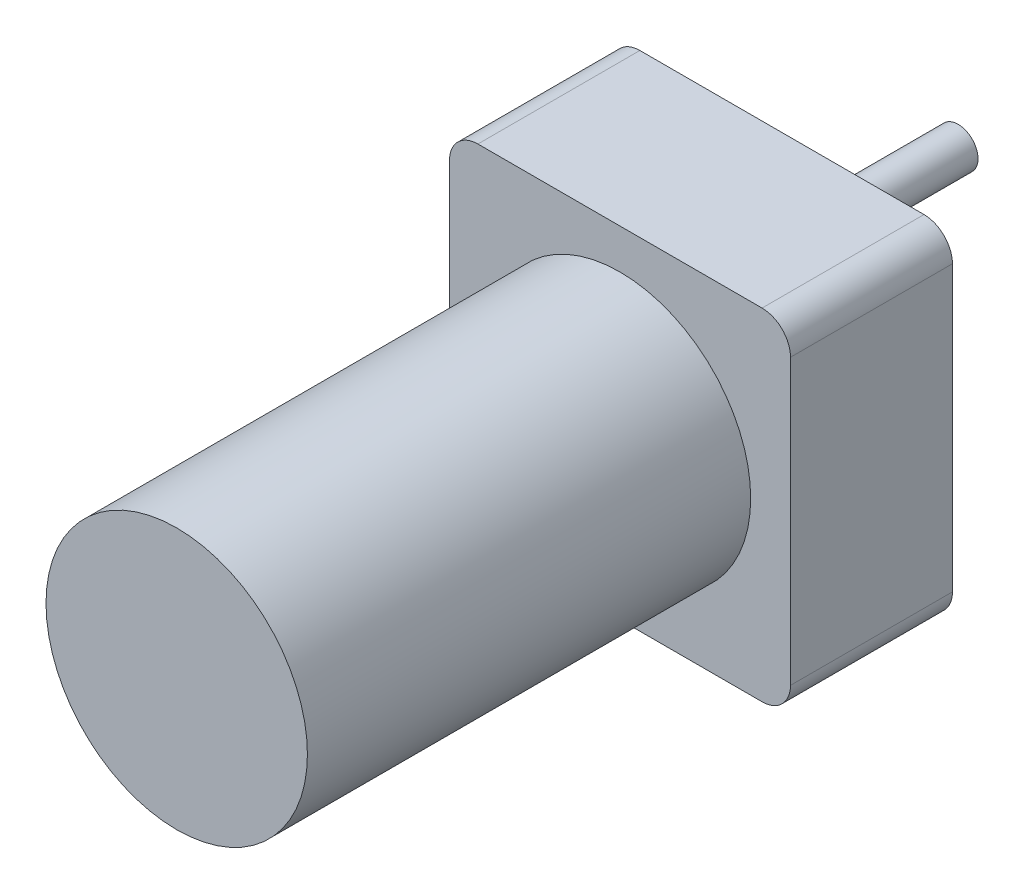
from build123d import *

# Parameters (mm, degrees)
BOSS_EXTRUDE1_DEPTH = 28.5
SKETCH2_R           = 23
BOSS_EXTRUDE2_DEPTH = 78
SKETCH3_R           = 9.125
BOSS_EXTRUDE3_DEPTH = 6
SKETCH4_R           = 3.5
BOSS_EXTRUDE4_DEPTH = 25
CUT_EXTRUDE1_START  = -18
CUT_EXTRUDE1_DEPTH  = 18
SKETCH6_R           = 2.4
CUT_EXTRUDE2_DEPTH  = 10
SKETCH7_R           = 12.5
SKETCH7_R_2         = 9.125
BOSS_EXTRUDE5_DEPTH = 3


with BuildPart() as part:
    # Sketch1 → Boss-Extrude1 (new body)
    with BuildSketch(Plane.XY):
        with BuildLine():
            Line((5, 0), (55, 0))
            ThreePointArc((55, 0), (58.535533906, 1.464466094), (60, 5))
            Line((60, 5), (60, 55))
            ThreePointArc((60, 55), (58.535533906, 58.535533906), (55, 60))
            Line((55, 60), (5, 60))
            ThreePointArc((5, 60), (1.464466094, 58.535533906), (0, 55))
            Line((0, 55), (0, 5))
            ThreePointArc((0, 5), (1.464466094, 1.464466094), (5, 0))
        make_face()
    extrude(amount=BOSS_EXTRUDE1_DEPTH)

    # Sketch2 → Boss-Extrude2 (add)
    with BuildSketch(Plane.XY.offset(28.5)):
        with Locations((30, 30)):
            Circle(SKETCH2_R)
    extrude(amount=BOSS_EXTRUDE2_DEPTH)

    # Sketch3 → Boss-Extrude3 (add)
    with BuildSketch(Plane(origin=(0, 0, 0), x_dir=(-1, 0, 0), z_dir=(0, 0, -1))):
        with Locations((-30, 40)):
            Circle(SKETCH3_R)
    extrude(amount=BOSS_EXTRUDE3_DEPTH)

    # Sketch4 → Boss-Extrude4 (add)
    with BuildSketch(Plane(origin=(0, 0, -6), x_dir=(-1, 0, 0), z_dir=(0, 0, -1))):
        with Locations((-30, 42.25)):
            Circle(SKETCH4_R)
    extrude(amount=BOSS_EXTRUDE4_DEPTH)

    # Sketch5 → Cut-Extrude1 (cut)
    with BuildSketch(Plane(origin=(0, 0, -31), x_dir=(-1, 0, 0), z_dir=(0, 0, -1)).offset(CUT_EXTRUDE1_START)):
        with BuildLine():
            Line((-32.5, 39.800510257), (-27.5, 39.800510257))
            ThreePointArc((-27.5, 39.800510257), (-30, 38.75), (-32.5, 39.800510257))
        make_face()
    extrude(amount=CUT_EXTRUDE1_DEPTH, mode=Mode.SUBTRACT)

    # Sketch6 → Cut-Extrude2 (cut)
    with BuildSketch(Plane(origin=(0, 0, 0), x_dir=(-1, 0, 0), z_dir=(0, 0, -1))):
        with Locations((-54.75, 54.75)):
            Circle(SKETCH6_R)
        with Locations((-5.25, 54.75)):
            Circle(SKETCH6_R)
        with Locations((-5.25, 5.25)):
            Circle(SKETCH6_R)
        with Locations((-54.75, 5.25)):
            Circle(SKETCH6_R)
    extrude(amount=-CUT_EXTRUDE2_DEPTH, mode=Mode.SUBTRACT)

    # Sketch7 → Boss-Extrude5 (add)
    with BuildSketch(Plane(origin=(0, 0, 0), x_dir=(-1, 0, 0), z_dir=(0, 0, -1))):
        with Locations((-30, 40)):
            Circle(SKETCH7_R)
        with Locations((-30, 40)):
            Circle(SKETCH7_R_2, mode=Mode.SUBTRACT)
    extrude(amount=BOSS_EXTRUDE5_DEPTH)


solid = part.part
